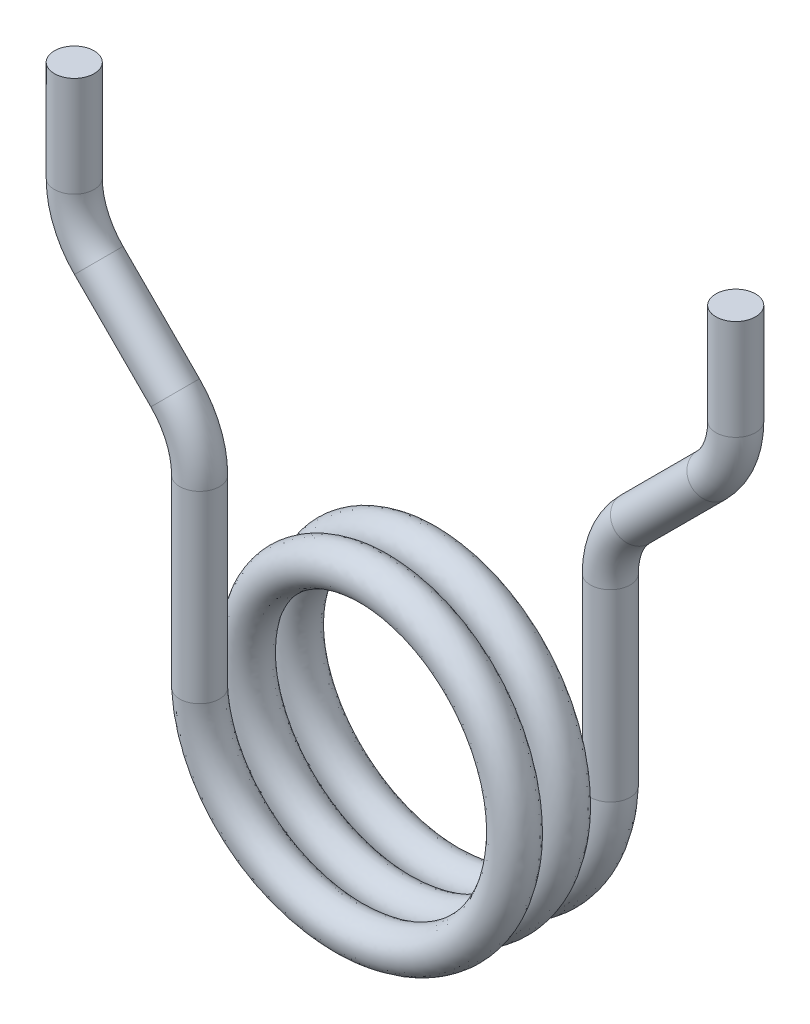
from build123d import *

# Parameters (mm, degrees)
VARREDURA1_PITCH  = 5.75
VARREDURA1_HEIGHT = 14.375
VARREDURA1_RADIUS = 17.375
ESBO_O2_R         = 2.375
ESBO_O2_7_R       = 2.375
ESBO_O3_R         = 2.375


with BuildPart() as part:
    # Varredura1: sweep along a helix
    with BuildLine() as varredura1_path:
        Helix(VARREDURA1_PITCH, VARREDURA1_HEIGHT, VARREDURA1_RADIUS, center=(0, 0, 0), direction=(0, 0, 1), lefthand=True)
    # Esboço2 → Varredura1 (sweep)
    with BuildSketch(Plane(origin=(0, 0, 0), x_dir=(1, 0, 0), z_dir=(0, 1, 0))):
        with Locations((17.375, 0)):
            Circle(ESBO_O2_R)
    sweep(path=varredura1_path.line, is_frenet=True)

    # Varredura2: sweep along a path in Esboço8
    with BuildLine(Plane.XY) as varredura2_path:
        Line((17.375, 0), (17.375, 22))
        ThreePointArc((17.375, 22), (18.136204675, 25.826834324), (20.303932188, 29.071067812))
        Line((20.303932188, 29.071067812), (29.446067812, 38.213203436))
        ThreePointArc((29.446067812, 38.213203436), (31.613795325, 41.457436924), (32.375, 45.284271247))
        Line((32.375, 45.284271247), (32.375, 57.284271247))
    # Esboço2<7> → Varredura2 (sweep)
    with BuildSketch(Plane(origin=(0, 0, 0), x_dir=(1, 0, 0), z_dir=(0, 1, 0))):
        with Locations((17.375, 0)):
            Circle(ESBO_O2_7_R)
    sweep(path=varredura2_path.line)

    # Varredura3: sweep along a path in Esboço5
    with BuildLine(Plane.XY.offset(14.375)) as varredura3_path:
        Line((-17.375, 0), (-17.375, 22))
        ThreePointArc((-17.375, 22), (-18.136204675, 25.826834324), (-20.303932188, 29.071067812))
        Line((-20.303932188, 29.071067812), (-29.446067812, 38.213203436))
        ThreePointArc((-29.446067812, 38.213203436), (-31.613795325, 41.457436924), (-32.375, 45.284271247))
        Line((-32.375, 45.284271247), (-32.375, 57.284271247))
    # Esboço3 → Varredura3 (sweep)
    with BuildSketch(Plane(origin=(0, 0, 0), x_dir=(1, 0, 0), z_dir=(0, 1, 0))):
        with Locations((-17.375, -14.375)):
            Circle(ESBO_O3_R)
    sweep(path=varredura3_path.line)


solid = part.part
